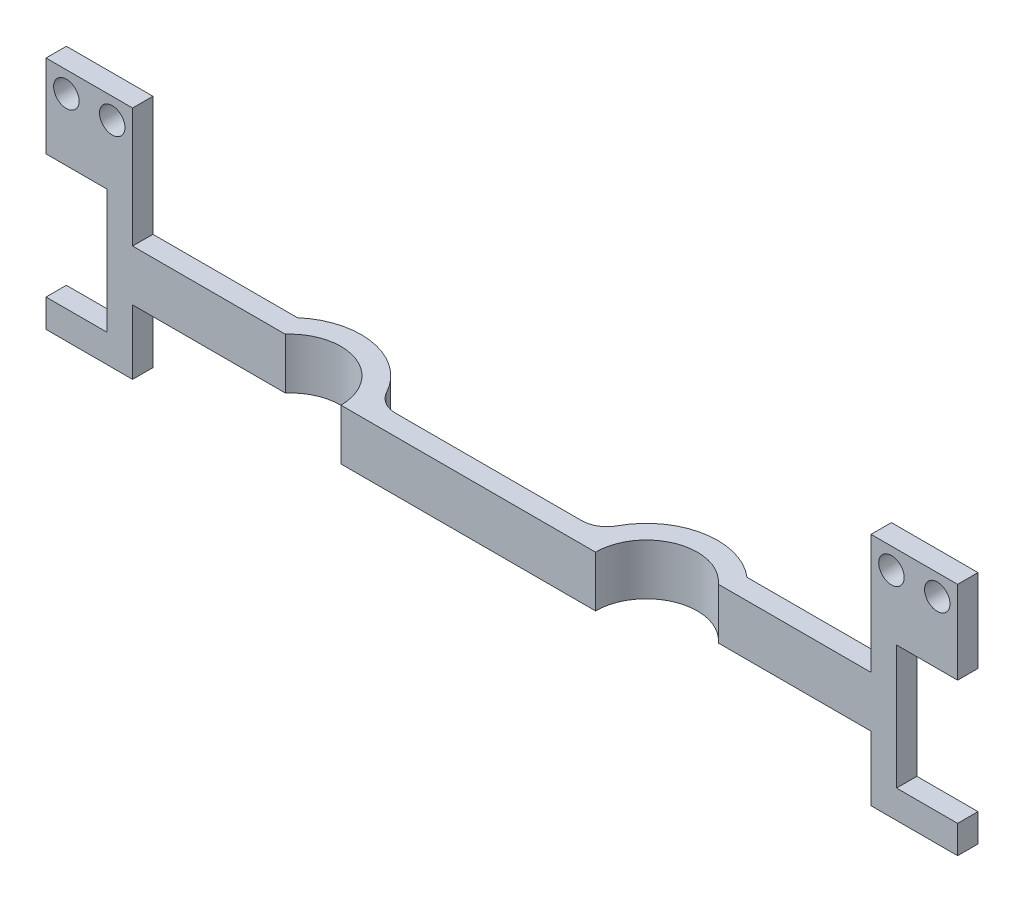
from build123d import *

# Parameters (mm, degrees)
BOSS_EXTRUDE1_DEPTH = 12.7
BOSS_EXTRUDE3_DEPTH = 5.08
SKETCH4_R           = 3.175
CUT_EXTRUDE2_DEPTH  = 5.08


with BuildPart() as part:
    # Sketch1 → Boss-Extrude1 (new body)
    with BuildSketch(Plane(origin=(0, 0, 0), x_dir=(1, 0, 0), z_dir=(0, 1, 0))):
        with BuildLine():
            Line((0, 0), (63.5, 0))
            ThreePointArc((63.5, 0), (71.721251762, 11.884057145), (85.741073105, 8.382))
            Line((85.741073105, 8.382), (123.841073105, 8.382))
            Line((123.841073105, 8.382), (123.841073105, 13.462))
            Line((123.841073105, 13.462), (87.814773179, 13.462))
            ThreePointArc((87.814773179, 13.462), (72.969121208, 17.483987595), (60.541247082, 8.422105263))
            ThreePointArc((60.541247082, 8.422105263), (58.206316594, 5.979191272), (54.948835326, 5.08))
            Line((54.948835326, 5.08), (8.551164674, 5.08))
            ThreePointArc((8.551164674, 5.08), (5.293683406, 5.979191272), (2.958752918, 8.422105263))
            ThreePointArc((2.958752918, 8.422105263), (-9.469121208, 17.483987595), (-24.314773179, 13.462))
            Line((-24.314773179, 13.462), (-60.341073105, 13.462))
            Line((-60.341073105, 13.462), (-60.341073105, 8.382))
            Line((-60.341073105, 8.382), (-22.241073105, 8.382))
            ThreePointArc((-22.241073105, 8.382), (-8.221251762, 11.884057145), (0, 0))
        make_face()
    extrude(amount=BOSS_EXTRUDE1_DEPTH)

    # Sketch3 → Boss-Extrude3 (add)
    with BuildSketch(Plane(origin=(0, 0, -13.462), x_dir=(-1, 0, 0), z_dir=(0, 0, -1))):
        Polygon((81.931073105, -16.1036), (60.341073105, -16.1036), (60.341073105, 28.8036), (60.341073105, 42.5196), (81.931073105, 42.5196), (81.931073105, 28.8036), (81.931073105, 21.8059), (66.691073105, 21.8059), (66.691073105, -9.1059), (81.931073105, -9.1059), align=None)
        Polygon((-123.841073105, -16.1036), (-123.841073105, 28.8036), (-123.841073105, 42.5196), (-145.431073105, 42.5196), (-145.431073105, 28.8036), (-145.431073105, 21.8059), (-130.191073105, 21.8059), (-130.191073105, -9.1059), (-145.431073105, -9.1059), (-145.431073105, -16.1036), align=None)
    extrude(amount=-BOSS_EXTRUDE3_DEPTH)

    # Sketch4 → Cut-Extrude2 (cut)
    with BuildSketch(Plane(origin=(0, 0, -13.462), x_dir=(-1, 0, 0), z_dir=(0, 0, -1))):
        with Locations((-140.351073105, 37.32276)):
            Circle(SKETCH4_R)
        with Locations((-128.921073105, 37.32276)):
            Circle(SKETCH4_R)
        with Locations((65.421073105, 37.32276)):
            Circle(SKETCH4_R)
        with Locations((76.851073105, 37.32276)):
            Circle(SKETCH4_R)
    extrude(amount=-CUT_EXTRUDE2_DEPTH, mode=Mode.SUBTRACT)


solid = part.part
